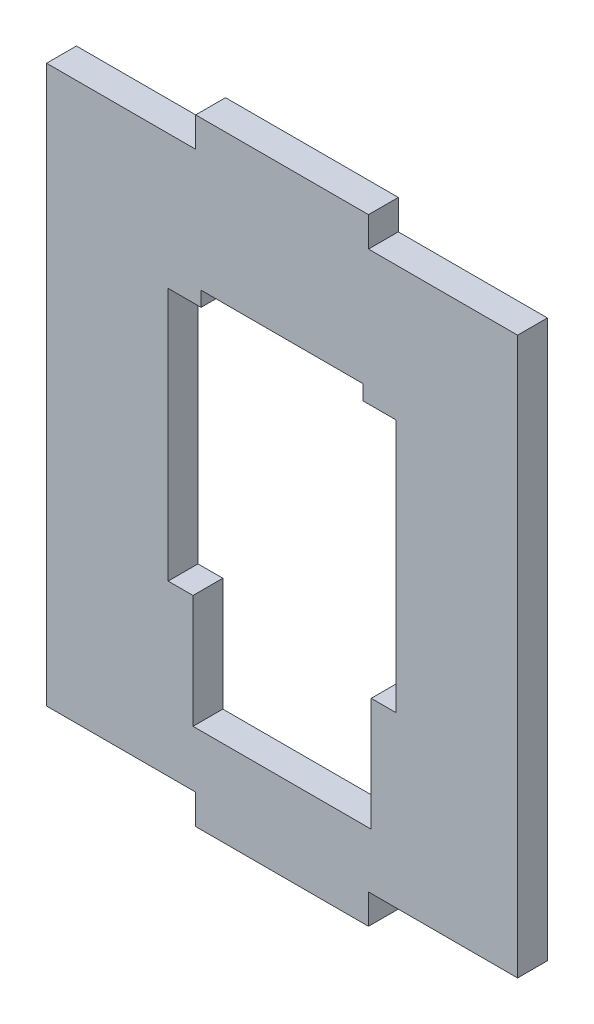
from build123d import *

# Parameters (mm, degrees)
P_IDAT_VYSUNUT_M1_DEPTH = 3


with BuildPart() as part:
    # Skica1 → Přidat vysunutím1 (new body)
    with BuildSketch(Plane.XY):
        Polygon((0, 3), (15, 3), (15, 0), (32.38, 0), (32.38, 3), (47.38, 3), (47.38, 59), (32.38, 59), (32.38, 62), (15, 62), (15, 59), (0, 59), align=None)
        Polygon((12.227967454, 31), (12.227967454, 45.5), (15.539999999, 45.5), (15.539999999, 47), (31.839999999, 47), (31.839999999, 45.5), (35.152032457, 45.5), (35.152032457, 31), (35.152032457, 20), (32.652032457, 20), (32.652032457, 8.6), (14.727967454, 8.6), (14.727967454, 20), (12.227967454, 20), align=None, mode=Mode.SUBTRACT)
    extrude(amount=P_IDAT_VYSUNUT_M1_DEPTH)


solid = part.part
